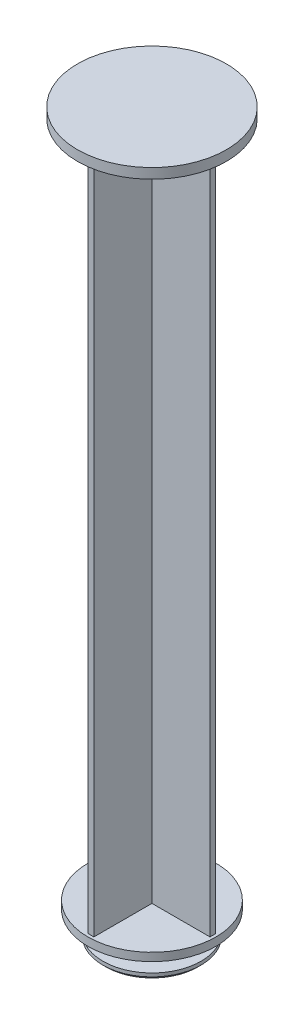
from build123d import *

# Parameters (mm, degrees)
SKETCH1_R           = 7.25
BOSS_EXTRUDE1_DEPTH = 1
CHAMFER1_SIZE       = 0.5
SKETCH2_W           = 1.2
SKETCH2_H           = 11
BOSS_EXTRUDE2_DEPTH = 3
SKETCH3_R           = 9.45
BOSS_EXTRUDE3_DEPTH = 1.2
SKETCH4_W           = 0.85
SKETCH4_H           = 18
BOSS_EXTRUDE4_DEPTH = 100
CIRPATTERN2_COUNT   = 2
CIRPATTERN2_ANGLE   = 90
SKETCH6_R           = 11
BOSS_EXTRUDE5_DEPTH = 1.5


with BuildPart() as part:
    # Sketch1 → Boss-Extrude1 (new body)
    with BuildSketch(Plane(origin=(0, 0, 0), x_dir=(1, 0, 0), z_dir=(0, 1, 0))):
        with Locations(Location((0, 0, 0), (0, 0, 270))):
            Circle(SKETCH1_R)
    extrude(amount=BOSS_EXTRUDE1_DEPTH)

    # Chamfer1
    chamfer1_edges = [part.edges().sort_by_distance(p)[0] for p in [
        (0, 0, -7.25),
    ]]
    chamfer(chamfer1_edges, length=CHAMFER1_SIZE)

    # Sketch2 → Boss-Extrude2 (add)
    with BuildSketch(Plane(origin=(0, 1, 0), x_dir=(1, 0, 0), z_dir=(0, 1, 0))):
        Rectangle(SKETCH2_W, SKETCH2_H)
    boss_extrude2 = extrude(amount=BOSS_EXTRUDE2_DEPTH)

    # Sketch3 → Boss-Extrude3 (add)
    with BuildSketch(Plane(origin=(0, 4, 0), x_dir=(1, 0, 0), z_dir=(0, 1, 0))):
        with Locations(Location((0, 0, 0), (0, 0, 270))):
            Circle(SKETCH3_R)
    extrude(amount=BOSS_EXTRUDE3_DEPTH)

    # Sketch4 → Boss-Extrude4 (add)
    with BuildSketch(Plane(origin=(0, 5.2, 0), x_dir=(1, 0, 0), z_dir=(0, 1, 0))):
        Rectangle(SKETCH4_W, SKETCH4_H)
    boss_extrude4 = extrude(amount=BOSS_EXTRUDE4_DEPTH)

    # CirPattern2: Boss-Extrude2, Boss-Extrude4 ×2 about axis
    cirpattern2_axis = Axis((0, 0, 0), (0, 1, 0))
    add([boss_extrude2.rotate(cirpattern2_axis, i * CIRPATTERN2_ANGLE / (CIRPATTERN2_COUNT - 1)) for i in range(1, CIRPATTERN2_COUNT)])
    add([boss_extrude4.rotate(cirpattern2_axis, i * CIRPATTERN2_ANGLE / (CIRPATTERN2_COUNT - 1)) for i in range(1, CIRPATTERN2_COUNT)])

    # Sketch6 → Boss-Extrude5 (add)
    with BuildSketch(Plane(origin=(0, 105.2, 0), x_dir=(1, 0, 0), z_dir=(0, 1, 0))):
        with Locations(Location((0, 0, 0), (0, 0, 270))):
            Circle(SKETCH6_R)
    extrude(amount=BOSS_EXTRUDE5_DEPTH)


solid = part.part
